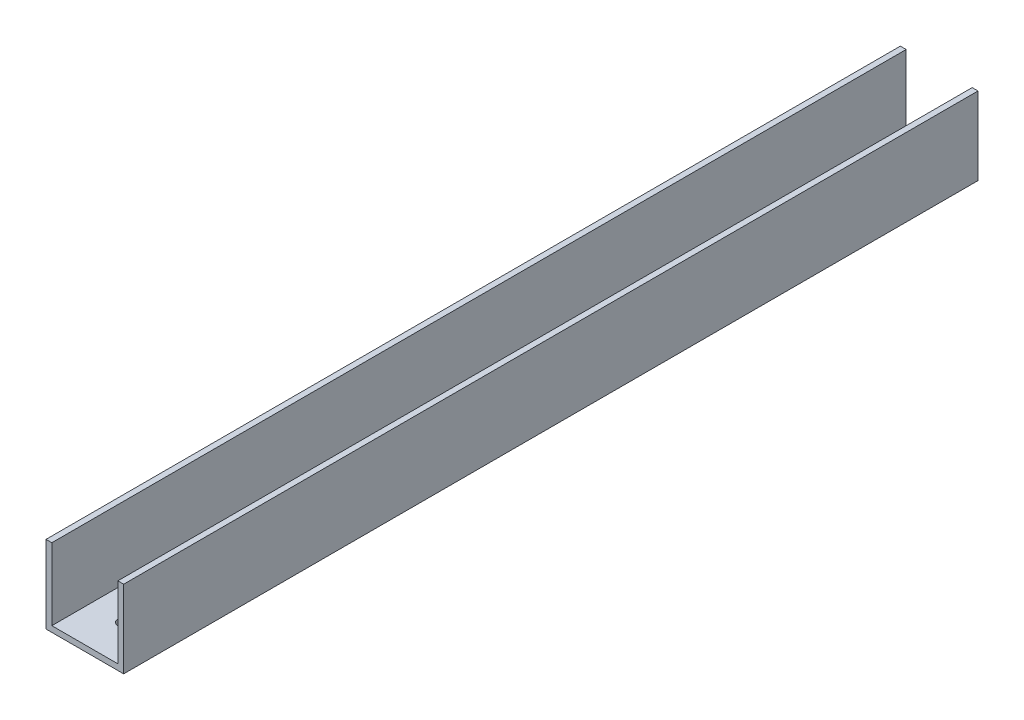
from build123d import *

# Parameters (mm, degrees)
EXTRUSION1_DEPTH = 220
ESQUISSE2_R      = 1.5
EXTRUSION2_DEPTH = 200


with BuildPart() as part:
    # Esquisse1 → Extrusion1 (new body)
    with BuildSketch(Plane.XY):
        Polygon((-25.845256994, 11.357120085), (-25.845256994, -8.642879915), (-5.845256994, -8.642879915), (-5.845256994, 11.357120085), (-7.345256994, 11.357120085), (-7.345256994, -7.142879915), (-24.345256994, -7.142879915), (-24.345256994, 11.357120085), align=None)
    extrude(amount=EXTRUSION1_DEPTH)

    # Esquisse2 → Extrusion2 (cut)
    with BuildSketch(Plane.XZ.offset(8.642879915)):
        with Locations(Location((-15.845256994, 210, 0), (0, 0, 270))):
            Circle(ESQUISSE2_R)
        with Locations(Location((-15.845256994, 10, 0), (0, 0, 270))):
            Circle(ESQUISSE2_R)
        with Locations(Location((-15.845256994, 160, 0), (0, 0, 270))):
            Circle(ESQUISSE2_R)
        with Locations(Location((-15.845256994, 110, 0), (0, 0, 270))):
            Circle(ESQUISSE2_R)
        with Locations(Location((-15.845256994, 60, 0), (0, 0, 270))):
            Circle(ESQUISSE2_R)
    extrude(amount=-EXTRUSION2_DEPTH, mode=Mode.SUBTRACT)


solid = part.part
